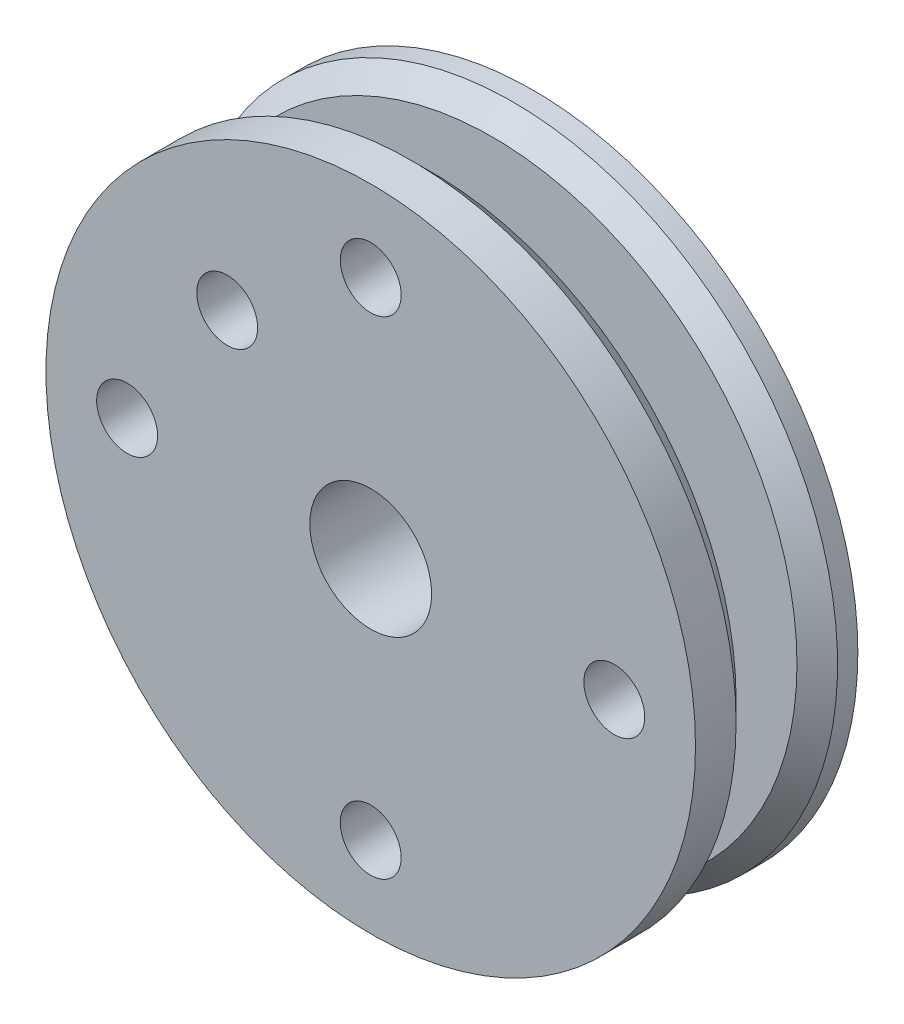
from build123d import *

# Parameters (mm, degrees)
SKIZZE2_R                        = 8
AUFSATZ_LINEAR_AUSTRAGEN1_DEPTH  = 4
F_3_0_3_DURCHMESSER_BOHRUNG1_D   = 3
SKIZZE8_R                        = 0.75
AUFSATZ_LINEAR_AUSTRAGEN2_DEPTH  = 2
F_1_5_1_5_DURCHMESSER_BOHRUNG1_D = 1.5
FASE1_SIZE                       = 0.5
FASE2_SIZE                       = 0.3
SKIZZE16_R                       = 0.75
SCHNITT_LINEAR_AUSTRAGEN1_DEPTH  = 5


with BuildPart() as part:
    # Skizze2 → Aufsatz-Linear austragen1 (new body)
    with BuildSketch(Plane.XY):
        Circle(SKIZZE2_R)
    extrude(amount=AUFSATZ_LINEAR_AUSTRAGEN1_DEPTH)

    # Ø3.0 (3) Durchmesser Bohrung1 (through all)
    with Locations(Plane(origin=(0, 0, 0), x_dir=(-1, 0, 0), z_dir=(0, 0, -1))):
        with Locations((0, 0)):
            Hole(F_3_0_3_DURCHMESSER_BOHRUNG1_D / 2)

    # Skizze9 → Schnitt-Rotation2 (revolve, cut)
    with BuildSketch(Plane(origin=(0, 0, 0), x_dir=(1, 0, 0), z_dir=(0, 1, 0))):
        with BuildLine():
            Line((-4.5, -2.5), (-8, -2.5))
            Line((-8, -2.5), (-8, -1))
            Line((-8, -1), (-4.5, -1))
            ThreePointArc((-4.5, -1), (-3.75, -1.75), (-4.5, -2.5))
        make_face()
    revolve(axis=Axis((0, 0, 0), (0, 0, 1)), mode=Mode.SUBTRACT)

    # Skizze8 → Aufsatz-Linear austragen2 (add)
    with BuildSketch(Plane.XY.offset(4)):
        with Locations((0, 6)):
            Circle(SKIZZE8_R)
        with Locations((6, 0)):
            Circle(SKIZZE8_R)
        with Locations((0, -6)):
            Circle(SKIZZE8_R)
        with Locations((-6, 0)):
            Circle(SKIZZE8_R)
    extrude(amount=AUFSATZ_LINEAR_AUSTRAGEN2_DEPTH)

    # Ø1.5 (1.5) Durchmesser Bohrung1 (through all)
    with Locations(Plane(origin=(0, 0, 0), x_dir=(1, 0, 0), z_dir=(0, 0, -1))):
        with Locations((-3.535533906, -3.535533906)):
            Hole(F_1_5_1_5_DURCHMESSER_BOHRUNG1_D / 2)

    # Fase1
    fase1_edges = [part.edges().sort_by_distance(p)[0] for p in [
        (-8, 0, 2.5),
        (-8, 0, 1),
    ]]
    chamfer(fase1_edges, length=FASE1_SIZE)

    # Fase2
    fase2_edges = [part.edges().sort_by_distance(p)[0] for p in [
        (-0.75, 6, 6),
        (5.25, 0, 6),
        (-0.75, -6, 6),
        (-6.75, 0, 6),
    ]]
    chamfer(fase2_edges, length=FASE2_SIZE)

    # Skizze16 → Schnitt-Linear austragen1 (cut)
    with BuildSketch(Plane.XY.offset(2)):
        with Locations((0, 6)):
            Circle(SKIZZE16_R)
        with Locations((6, 0)):
            Circle(SKIZZE16_R)
        with Locations((0, -6)):
            Circle(SKIZZE16_R)
        with Locations((-6, 0)):
            Circle(SKIZZE16_R)
    extrude(amount=SCHNITT_LINEAR_AUSTRAGEN1_DEPTH, mode=Mode.SUBTRACT)


solid = part.part
